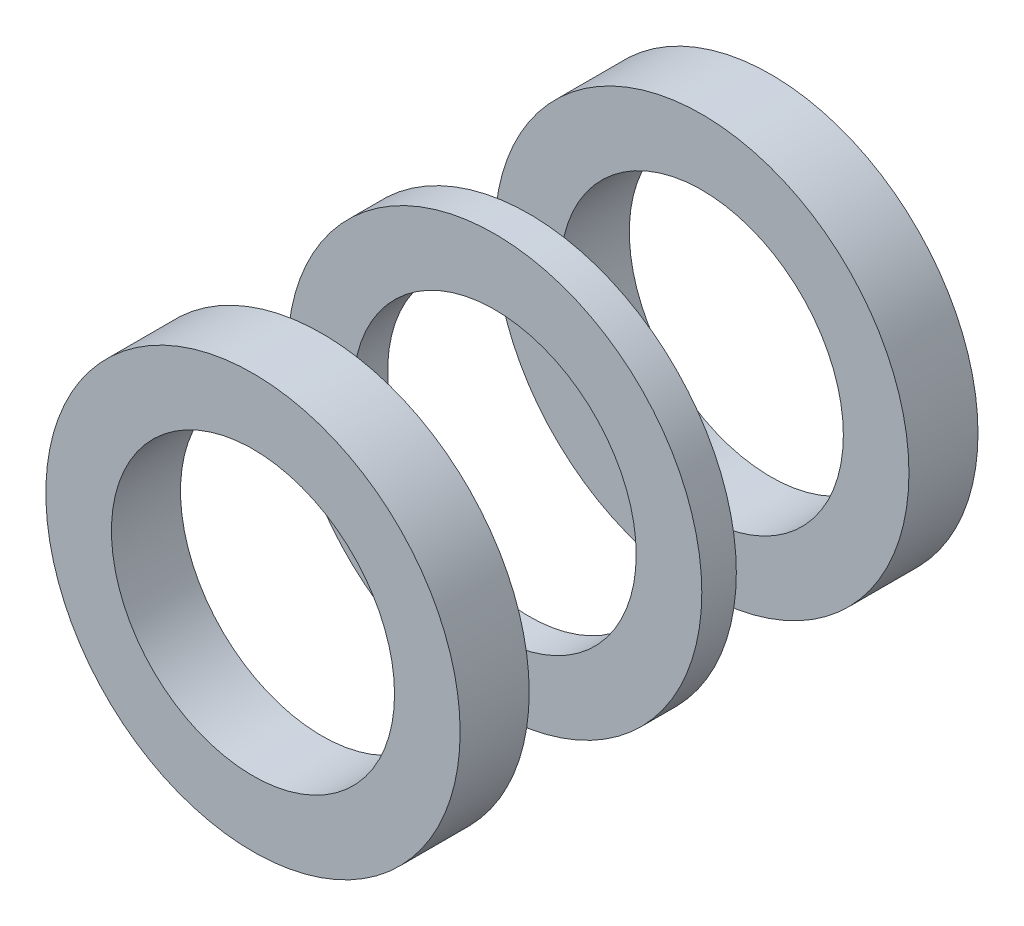
from build123d import *

# Parameters (mm, degrees)
REAR_START   = 29.5
SKETCH_1_R   = 6
SKETCH_1_R_2 = 4.1
REAR_DEPTH   = 2
MIDDLE_START = 36.5
SKETCH_2_R   = 6
SKETCH_2_R_2 = 4.1
MIDDLE_DEPTH = 1
FRONT_START  = 42.5
SKETCH_3_R   = 6
SKETCH_3_R_2 = 4.1
FRONT_DEPTH  = 2


with BuildPart() as part:
    # Эскиз1 → Rear (new body)
    with BuildSketch(Plane.XY.offset(REAR_START)):
        Circle(SKETCH_1_R)
        Circle(SKETCH_1_R_2, mode=Mode.SUBTRACT)
    extrude(amount=REAR_DEPTH)


with BuildPart() as body_2:
    # Эскиз2 → Middle (new body)
    with BuildSketch(Plane.XY.offset(MIDDLE_START)):
        Circle(SKETCH_2_R)
        Circle(SKETCH_2_R_2, mode=Mode.SUBTRACT)
    extrude(amount=MIDDLE_DEPTH)


with BuildPart() as body_3:
    # Эскиз3 → Front (new body)
    with BuildSketch(Plane.XY.offset(FRONT_START)):
        Circle(SKETCH_3_R)
        Circle(SKETCH_3_R_2, mode=Mode.SUBTRACT)
    extrude(amount=FRONT_DEPTH)


solid = Compound([part.part, body_2.part, body_3.part])
